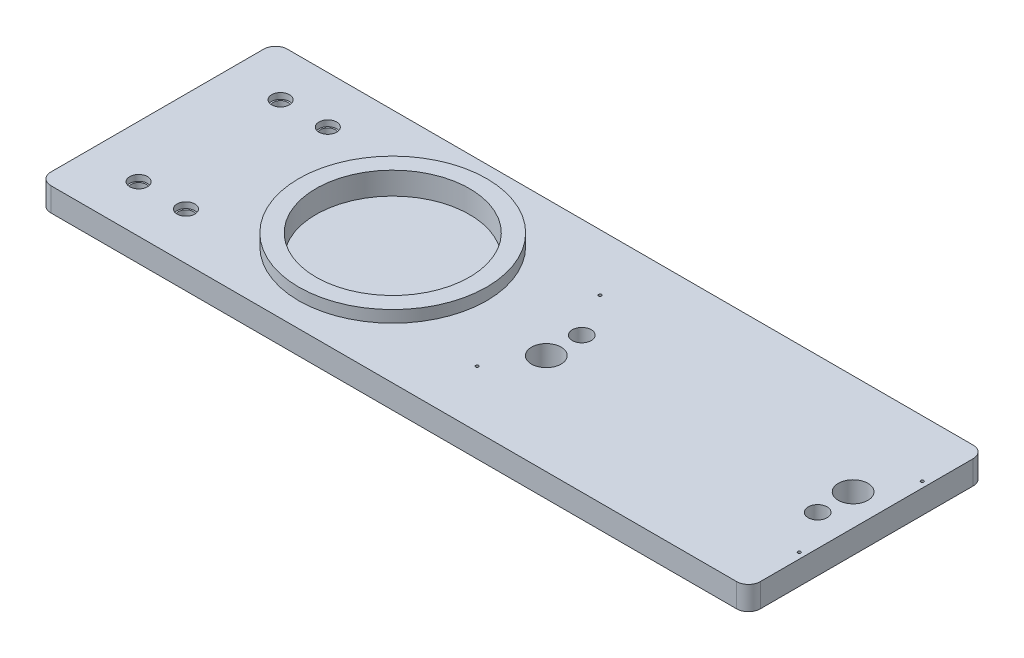
from build123d import *

# Parameters (mm, degrees)
SKETCH1_W           = 600
SKETCH1_H           = 200
BOSS_EXTRUDE1_DEPTH = 20
SKETCH2_R           = 6.25
CUT_EXTRUDE1_DEPTH  = 633.771680782
SKETCH4_R           = 7.5
CUT_EXTRUDE2_DEPTH  = 5
SKETCH5_R           = 1.25
CUT_EXTRUDE3_DEPTH  = 633.771680782
FILLET1_R           = 10
SKETCH6_R           = 79.491583248
BOSS_EXTRUDE2_DEPTH = 10
SKETCH7_R           = 64.936608028
CUT_EXTRUDE4_DEPTH  = 19
SKETCH8_R           = 12.5
SKETCH8_R_2         = 8
CUT_EXTRUDE5_DEPTH  = 633.771680782


with BuildPart() as part:
    # Sketch1 → Boss-Extrude1 (new body)
    with BuildSketch(Plane(origin=(0, 0, 0), x_dir=(1, 0, 0), z_dir=(0, 1, 0))):
        with Locations((-300, 100)):
            Rectangle(SKETCH1_W, SKETCH1_H)
    extrude(amount=BOSS_EXTRUDE1_DEPTH)

    # Sketch2 → Cut-Extrude1 (cut, through all)
    with BuildSketch(Plane(origin=(0, 20, 0), x_dir=(1, 0, 0), z_dir=(0, 1, 0))):
        with Locations(Location((-555.774, 160, 0), (0, 0, 270))):
            Circle(SKETCH2_R)
        with Locations(Location((-555.774, 40, 0), (0, 0, 270))):
            Circle(SKETCH2_R)
        with Locations(Location((-515.774, 40, 0), (0, 0, 90))):
            Circle(SKETCH2_R)
        with Locations(Location((-515.774, 160, 0), (0, 0, 90))):
            Circle(SKETCH2_R)
    extrude(amount=-CUT_EXTRUDE1_DEPTH, mode=Mode.SUBTRACT)

    # Sketch4 → Cut-Extrude2 (cut)
    with BuildSketch(Plane(origin=(0, 20, 0), x_dir=(1, 0, 0), z_dir=(0, 1, 0))):
        with Locations(Location((-555.774, 160, 0), (0, 0, 270))):
            Circle(SKETCH4_R)
        with Locations(Location((-555.774, 40, 0), (0, 0, 270))):
            Circle(SKETCH4_R)
        with Locations(Location((-515.774, 40, 0), (0, 0, 90))):
            Circle(SKETCH4_R)
        with Locations(Location((-515.774, 160, 0), (0, 0, 90))):
            Circle(SKETCH4_R)
    extrude(amount=-CUT_EXTRUDE2_DEPTH, mode=Mode.SUBTRACT)

    # Sketch5 → Cut-Extrude3 (cut, through all)
    with BuildSketch(Plane(origin=(0, 20, 0), x_dir=(1, 0, 0), z_dir=(0, 1, 0))):
        with Locations(Location((-277.5, 48, 0), (0, 0, 270))):
            Circle(SKETCH5_R)
        with Locations(Location((-277.5, 152, 0), (0, 0, 90))):
            Circle(SKETCH5_R)
        with Locations(Location((-5, 48, 0), (0, 0, 90))):
            Circle(SKETCH5_R)
        with Locations(Location((-5, 152, 0), (0, 0, 270))):
            Circle(SKETCH5_R)
    extrude(amount=-CUT_EXTRUDE3_DEPTH, mode=Mode.SUBTRACT)

    # Fillet1
    fillet1_edges = [part.edges().sort_by_distance(p)[0] for p in [
        (0, 10, 0),
        (-600, 10, 0),
        (-600, 10, -200),
        (0, 10, -200),
    ]]
    fillet(fillet1_edges, radius=FILLET1_R)

    # Sketch6 → Boss-Extrude2 (add)
    with BuildSketch(Plane(origin=(0, 20, 0), x_dir=(1, 0, 0), z_dir=(0, 1, 0))):
        with Locations(Location((-400.867107023, 100, 0), (0, 0, 270))):
            Circle(SKETCH6_R)
    extrude(amount=BOSS_EXTRUDE2_DEPTH)

    # Sketch7 → Cut-Extrude4 (cut)
    with BuildSketch(Plane(origin=(0, 30, 0), x_dir=(1, 0, 0), z_dir=(0, 1, 0))):
        with Locations(Location((-400.867107023, 100, 0), (0, 0, 270))):
            Circle(SKETCH7_R)
    extrude(amount=-CUT_EXTRUDE4_DEPTH, mode=Mode.SUBTRACT)

    # Sketch8 → Cut-Extrude5 (cut, through all)
    with BuildSketch(Plane(origin=(0, 20, 0), x_dir=(1, 0, 0), z_dir=(0, 1, 0))):
        with Locations(Location((-26.5, 115, 0), (0, 0, 270))):
            Circle(SKETCH8_R)
        with Locations(Location((-26.5, 85, 0), (0, 0, 270))):
            Circle(SKETCH8_R_2)
        with Locations(Location((-256, 115, 0), (0, 0, 270))):
            Circle(SKETCH8_R_2)
        with Locations(Location((-256, 85, 0), (0, 0, 270))):
            Circle(SKETCH8_R)
    extrude(amount=-CUT_EXTRUDE5_DEPTH, mode=Mode.SUBTRACT)


solid = part.part
